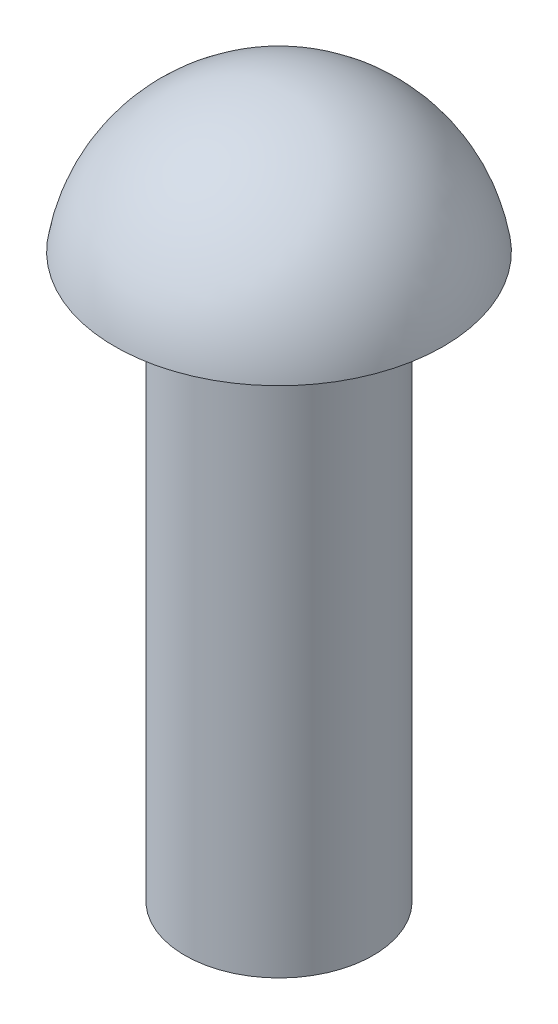
from build123d import *


with BuildPart() as part:
    # Sketch1 → Rivet Base (revolve)
    with BuildSketch(Plane.XY, mode=Mode.PRIVATE) as rivet_base_sk:
        with BuildLine():
            Line((0, 0), (4.3688, 0))
            Line((4.3688, 0), (4.3688, 26.1112))
            Line((4.3688, 26.1112), (7.628757967, 26.1112))
            ThreePointArc((7.628757967, 26.1112), (5.020212171, 30.784305174), (0, 32.639))
            Line((0, 32.639), (0, 0))
        make_face()
    revolve(rivet_base_sk.sketch.rotate(Axis((0, 32.639, 0), (0, -1, 0)), 180), axis=Axis((0, 32.639, 0), (0, -1, 0)))


solid = part.part
